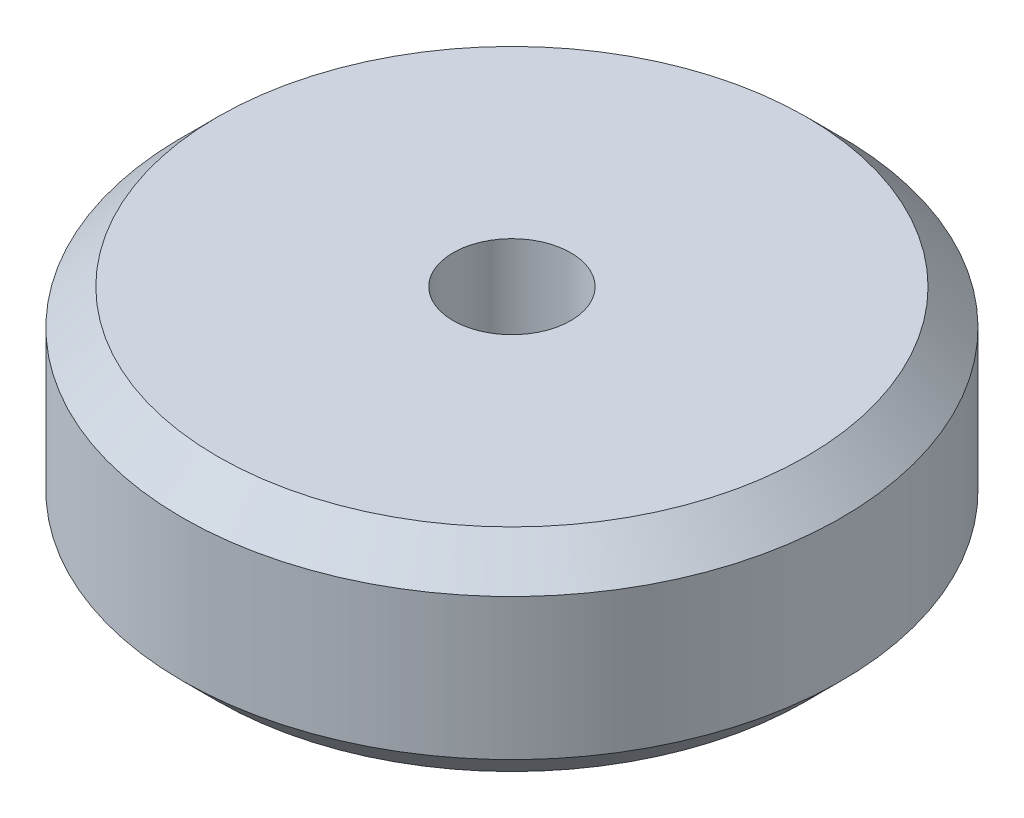
from build123d import *

# Parameters (mm, degrees)
SKETCH1_R           = 14
SKETCH1_R_2         = 2.5
BOSS_EXTRUDE1_DEPTH = 9
CHAMFER1_SIZE       = 1.5


with BuildPart() as part:
    # Sketch1 → Boss-Extrude1 (new body)
    with BuildSketch(Plane(origin=(0, 0, 0), x_dir=(1, 0, 0), z_dir=(0, 1, 0))):
        with Locations(Location((0, 0, 0), (0, 0, 270))):
            Circle(SKETCH1_R)
        with Locations(Location((0, 0, 0), (0, 0, 270))):
            Circle(SKETCH1_R_2, mode=Mode.SUBTRACT)
    extrude(amount=BOSS_EXTRUDE1_DEPTH)

    # Chamfer1
    chamfer1_edges = [part.edges().sort_by_distance(p)[0] for p in [
        (0, 0, -14),
        (0, 9, -14),
    ]]
    chamfer(chamfer1_edges, length=CHAMFER1_SIZE)


solid = part.part
